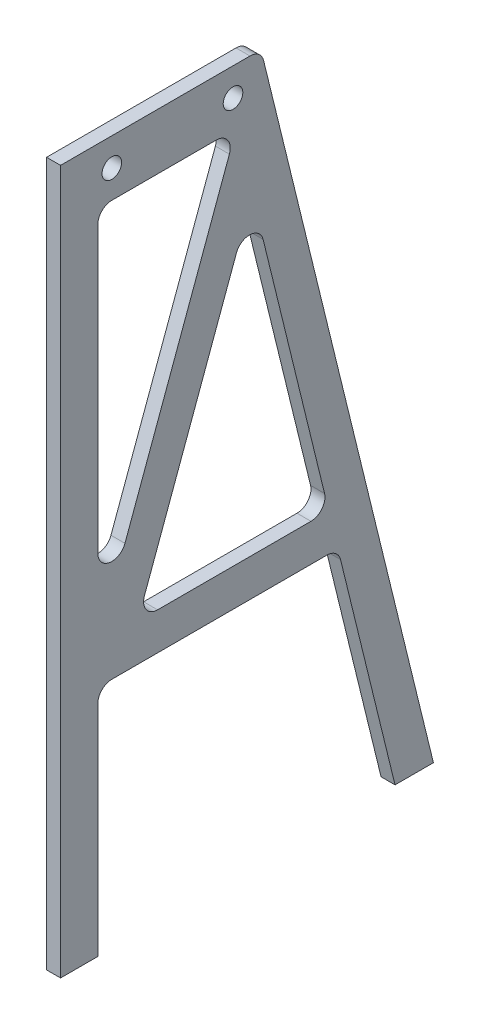
from build123d import *

# Parameters (mm, degrees)
SKETCH1_R           = 1.05
BOSS_EXTRUDE1_DEPTH = 1.5
FILLET1_R           = 1.5


with BuildPart() as part:
    # Sketch1 → Boss-Extrude1 (new body)
    with BuildSketch(Plane(origin=(0, 0, 0), x_dir=(0, 0, -1), z_dir=(1, 0, 0))):
        Polygon((0, 0), (0, 75.5), (21.5, 75.5), (40, 0), (35.881667859, 0), (29.755840045, 25), (4, 25), (4, 0), align=None)
        with Locations((5.5, 72.5)):
            Circle(SKETCH1_R, mode=Mode.SUBTRACT)
        with Locations((18.5, 72.5)):
            Circle(SKETCH1_R, mode=Mode.SUBTRACT)
        Polygon((4, 69.5), (18.851866535, 69.5), (4, 29), align=None, mode=Mode.SUBTRACT)
        Polygon((8.260475549, 29), (20.558388216, 62.535546651), (28.775707595, 29), align=None, mode=Mode.SUBTRACT)
    extrude(amount=BOSS_EXTRUDE1_DEPTH)

    # Fillet1
    fillet1_edges = [part.edges().sort_by_distance(p)[0] for p in [
        (0.75, 75.5, -21.5),
        (0.75, 25, -29.755840045),
        (0.75, 25, -4),
        (0.75, 69.5, -4),
        (0.75, 29, -4),
        (0.75, 69.5, -18.851866535),
        (0.75, 29, -8.260475549),
        (0.75, 29, -28.775707595),
        (0.75, 62.535546651, -20.558388216),
    ]]
    fillet(fillet1_edges, radius=FILLET1_R)


solid = part.part
